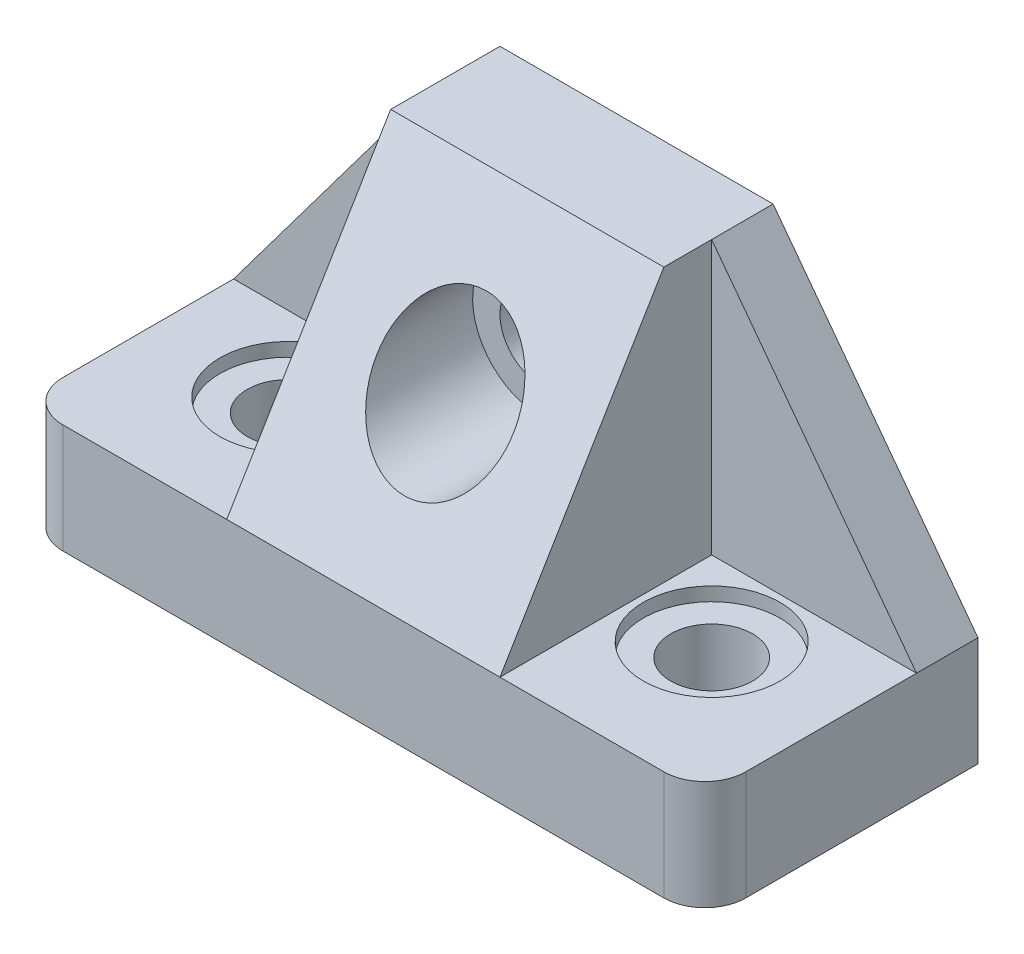
from build123d import *

# Parameters (mm, degrees)
SKETCH1_W           = 50
SKETCH1_H           = 20
BOSS_EXTRUDE1_DEPTH = 8
SKETCH2_W           = 20
SKETCH2_H           = 8
BOSS_EXTRUDE2_DEPTH = 20
RIB3_REACH          = 40.846
SKETCH3_WALL_W      = 103.015505978
SKETCH3_WALL_H      = 20
CUT_EXTRUDE3_START  = -3
SKETCH9_R           = 5
CUT_EXTRUDE3_DEPTH  = 12
SKETCH10_R          = 3
CUT_EXTRUDE4_DEPTH  = 7
RIB4_REACH          = 44.532
SKETCH12_WALL_W     = 112.064681272
SKETCH12_WALL_H     = 4.5
RIB7_REACH          = 44.532
SKETCH13_WALL_W     = 112.064681272
SKETCH13_WALL_H     = 4.5
SKETCH7_R           = 5
CUT_EXTRUDE5_DEPTH  = 1
SKETCH14_R          = 3
CUT_EXTRUDE6_DEPTH  = 7
LPATTERN1_COUNT     = 2
LPATTERN1_PITCH     = 31
SKETCH15_W          = 5.8
SKETCH15_H          = 3
BOSS_EXTRUDE3_DEPTH = 10
FILLET1_R           = 3
FILLET2_R           = 3


with BuildPart() as part:
    # Sketch1 → Boss-Extrude1 (new body)
    with BuildSketch(Plane(origin=(0, 0, 0), x_dir=(1, 0, 0), z_dir=(0, 1, 0))):
        Rectangle(SKETCH1_W, SKETCH1_H)
    extrude(amount=BOSS_EXTRUDE1_DEPTH)

    # Sketch2 → Boss-Extrude2 (add)
    with BuildSketch(Plane(origin=(0, 8, 0), x_dir=(1, 0, 0), z_dir=(0, 1, 0))):
        with Locations((0, 6)):
            Rectangle(SKETCH2_W, SKETCH2_H)
    extrude(amount=BOSS_EXTRUDE2_DEPTH)

    # Sketch3 wall → Rib3 (add, up to next)
    with BuildSketch(Plane(origin=(0, 18, 4), x_dir=(0, -0.857492925713, 0.514495755428), z_dir=(0, -0.514495755428, -0.857492925713)), mode=Mode.PRIVATE) as rib3_sk1:
        Rectangle(SKETCH3_WALL_W, SKETCH3_WALL_H)
    rib3_tool1 = extrude(rib3_sk1.sketch, amount=RIB3_REACH, mode=Mode.PRIVATE) - part.part
    add(rib3_tool1.solids().sort_by_distance((0, 18, 4))[0])

    # Sketch9 → Cut-Extrude3 (cut)
    with BuildSketch(Plane.XY.offset(CUT_EXTRUDE3_START)):
        with Locations(Location((0, 18, 0), (0, 0, 90))):
            Circle(SKETCH9_R)
    extrude(amount=CUT_EXTRUDE3_DEPTH, mode=Mode.SUBTRACT)

    # Sketch10 → Cut-Extrude4 (cut)
    with BuildSketch(Plane.XY.offset(-3)):
        with Locations((0, 18)):
            Circle(SKETCH10_R)
    extrude(amount=-CUT_EXTRUDE4_DEPTH, mode=Mode.SUBTRACT)

    # Sketch12 wall → Rib4 (add, up to next)
    with BuildSketch(Plane(origin=(-17.5, 18, -10), x_dir=(-0.6, -0.8, 0), z_dir=(-0.8, 0.6, 0)), mode=Mode.PRIVATE) as rib4_sk1:
        with Locations((0, 2.25)):
            Rectangle(SKETCH12_WALL_W, SKETCH12_WALL_H)
    rib4_tool1 = extrude(rib4_sk1.sketch, amount=-RIB4_REACH, mode=Mode.PRIVATE) - part.part
    add(rib4_tool1.solids().sort_by_distance((-17.5, 18, -10))[0])

    # Sketch13 wall → Rib7 (add, up to next)
    with BuildSketch(Plane(origin=(17.5, 18, -10), x_dir=(0.6, -0.8, 0), z_dir=(-0.8, -0.6, 0)), mode=Mode.PRIVATE) as rib7_sk1:
        with Locations((0, 2.25)):
            Rectangle(SKETCH13_WALL_W, SKETCH13_WALL_H)
    rib7_tool1 = extrude(rib7_sk1.sketch, amount=RIB7_REACH, mode=Mode.PRIVATE) - part.part
    add(rib7_tool1.solids().sort_by_distance((17.5, 18, -10))[0])

    # Sketch7 → Cut-Extrude5 (cut)
    with BuildSketch(Plane(origin=(0, 8, 0), x_dir=(1, 0, 0), z_dir=(0, 1, 0))):
        with Locations(Location((-15.5, 0, 0), (0, 0, 270))):
            Circle(SKETCH7_R)
    cut_extrude5 = extrude(amount=-CUT_EXTRUDE5_DEPTH, mode=Mode.SUBTRACT)

    # Sketch14 → Cut-Extrude6 (cut)
    with BuildSketch(Plane(origin=(0, 7, 0), x_dir=(1, 0, 0), z_dir=(0, 1, 0))):
        with Locations(Location((-15.5, 0, 0), (0, 0, 270))):
            Circle(SKETCH14_R)
    cut_extrude6 = extrude(amount=-CUT_EXTRUDE6_DEPTH, mode=Mode.SUBTRACT)

    # LPattern1: Cut-Extrude5, Cut-Extrude6 ×2
    with Locations(*[(i * LPATTERN1_PITCH, 0, 0) for i in range(1, LPATTERN1_COUNT)]):
        add(cut_extrude5, mode=Mode.SUBTRACT)
        add(cut_extrude6, mode=Mode.SUBTRACT)

    # Sketch15 → Boss-Extrude3 (add)
    with BuildSketch(Plane.XZ):
        with Locations((0, -11.5)):
            Rectangle(SKETCH15_W, SKETCH15_H)
    extrude(amount=-BOSS_EXTRUDE3_DEPTH)

    # Fillet1
    fillet1_edges = [part.edges().sort_by_distance(p)[0] for p in [
        (-25, 4, 10),
    ]]
    fillet(fillet1_edges, radius=FILLET1_R)

    # Fillet2
    fillet2_edges = [part.edges().sort_by_distance(p)[0] for p in [
        (25, 4, 10),
    ]]
    fillet(fillet2_edges, radius=FILLET2_R)


solid = part.part
